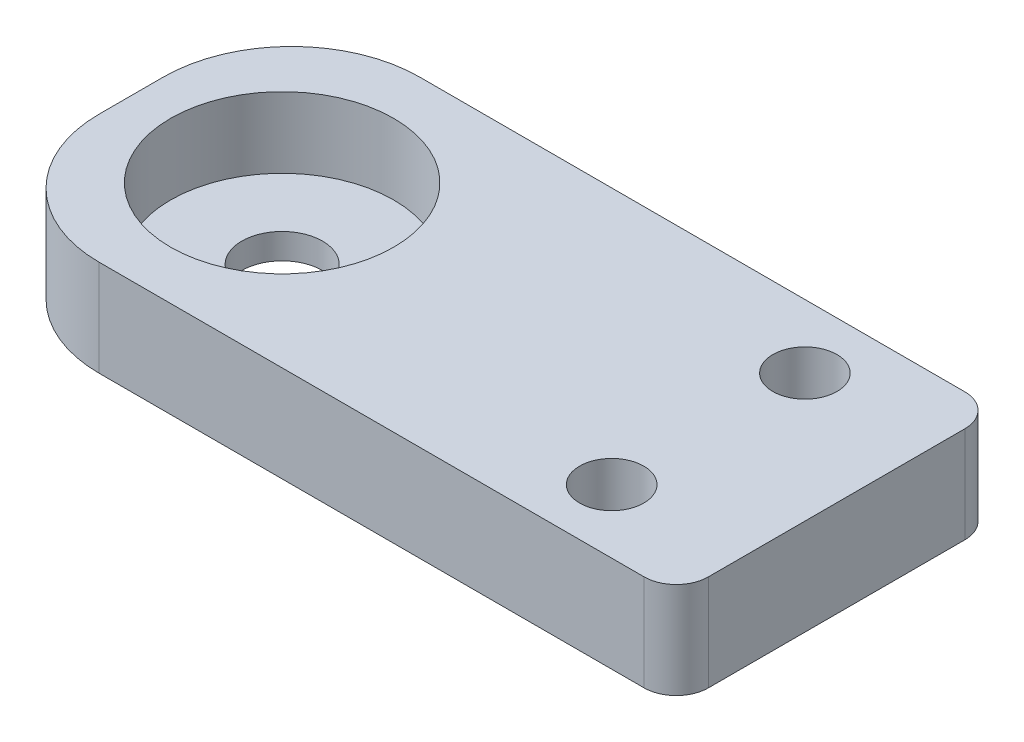
from build123d import *

# Parameters (mm, degrees)
SKETCH1_W           = 69.85
SKETCH1_H           = 31.75
SKETCH1_R           = 4
SKETCH1_R_2         = 3.175
BOSS_EXTRUDE1_DEPTH = 9.525
SKETCH2_R           = 11.05
CUT_EXTRUDE1_DEPTH  = 7
FILLET2_R           = 12.7
FILLET3_R           = 3.175


with BuildPart() as part:
    # Sketch1 → Boss-Extrude1 (new body)
    with BuildSketch(Plane(origin=(0, 0, 0), x_dir=(1, 0, 0), z_dir=(0, 1, 0))):
        with Locations((34.925, 15.875)):
            Rectangle(SKETCH1_W, SKETCH1_H)
        with Locations(Location((14.950000072, 15.875, 0), (0, 0, 90))):
            Circle(SKETCH1_R, mode=Mode.SUBTRACT)
        with Locations(Location((57.15, 25.441087639, 0), (0, 0, 90))):
            Circle(SKETCH1_R_2, mode=Mode.SUBTRACT)
        with Locations(Location((57.15, 6.308912361, 0), (0, 0, 90))):
            Circle(SKETCH1_R_2, mode=Mode.SUBTRACT)
    extrude(amount=BOSS_EXTRUDE1_DEPTH)

    # Sketch2 → Cut-Extrude1 (cut)
    with BuildSketch(Plane(origin=(0, 9.525, 0), x_dir=(1, 0, 0), z_dir=(0, 1, 0))):
        with Locations(Location((14.950000072, 15.875, 0), (0, 0, 270))):
            Circle(SKETCH2_R)
    extrude(amount=-CUT_EXTRUDE1_DEPTH, mode=Mode.SUBTRACT)

    # Fillet2
    fillet2_edges = [part.edges().sort_by_distance(p)[0] for p in [
        (0, 4.7625, -31.75),
        (0, 4.7625, 0),
    ]]
    fillet(fillet2_edges, radius=FILLET2_R)

    # Fillet3
    fillet3_edges = [part.edges().sort_by_distance(p)[0] for p in [
        (69.85, 4.7625, -31.75),
        (69.85, 4.7625, 0),
    ]]
    fillet(fillet3_edges, radius=FILLET3_R)


solid = part.part
